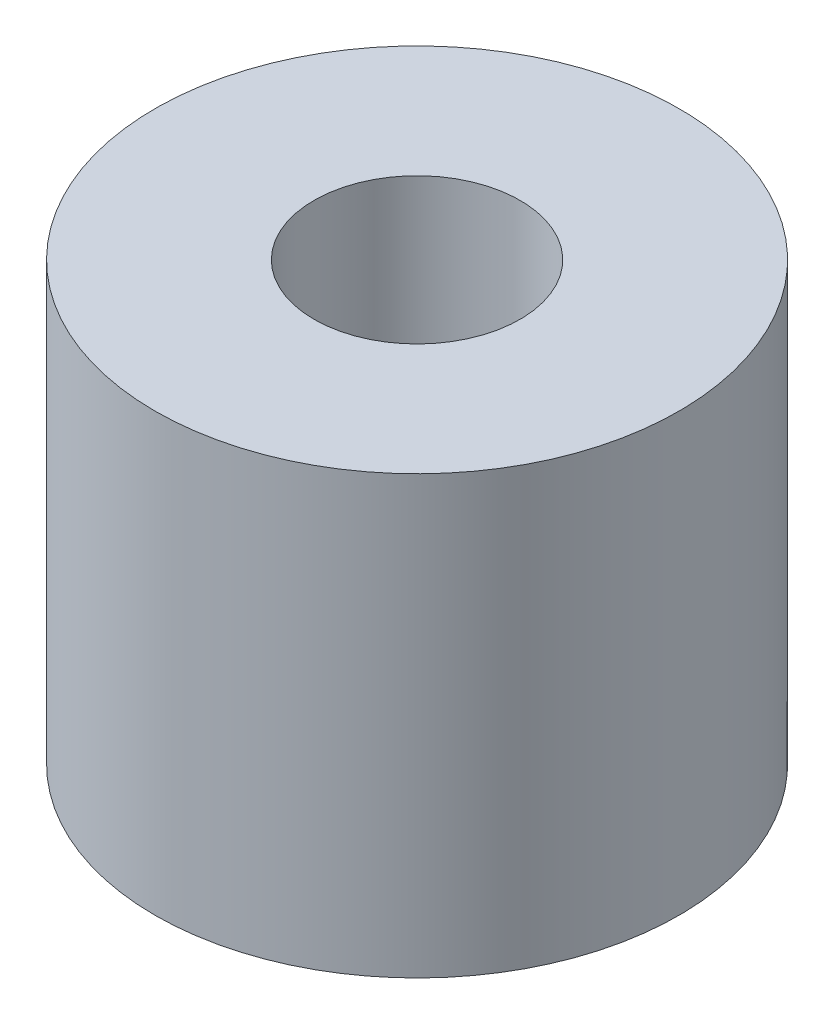
from build123d import *

# Parameters (mm, degrees)
SKETCH1_R               = 15
SKETCH1_R_2             = 2.5
BOSS_EXTRUDE1_DEPTH     = 25
G1_4_TAPPED_HOLE1_D     = 11.8
G1_4_TAPPED_HOLE1_DEPTH = 15
G1_4_TAPPED_HOLE1_TIP   = 3.545077652


with BuildPart() as part:
    # Sketch1 → Boss-Extrude1 (new body)
    with BuildSketch(Plane(origin=(0, 0, 0), x_dir=(1, 0, 0), z_dir=(0, 1, 0))):
        with Locations(Location((0, 0, 0), (0, 0, 270))):
            Circle(SKETCH1_R)
        with Locations(Location((0, 0, 0), (0, 0, 270))):
            Circle(SKETCH1_R_2, mode=Mode.SUBTRACT)
    extrude(amount=BOSS_EXTRUDE1_DEPTH)

    # G1/4 Tapped Hole1
    with Locations(Plane(origin=(0, 25, 0), x_dir=(1, 0, 0), z_dir=(0, 1, 0))):
        with Locations((0, 0)):
            Hole(G1_4_TAPPED_HOLE1_D / 2, depth=G1_4_TAPPED_HOLE1_DEPTH)
            with Locations((0, 0, -(G1_4_TAPPED_HOLE1_DEPTH + G1_4_TAPPED_HOLE1_TIP / 2))):  # 118° drill point
                Cone(0, G1_4_TAPPED_HOLE1_D / 2, G1_4_TAPPED_HOLE1_TIP, mode=Mode.SUBTRACT)


solid = part.part
